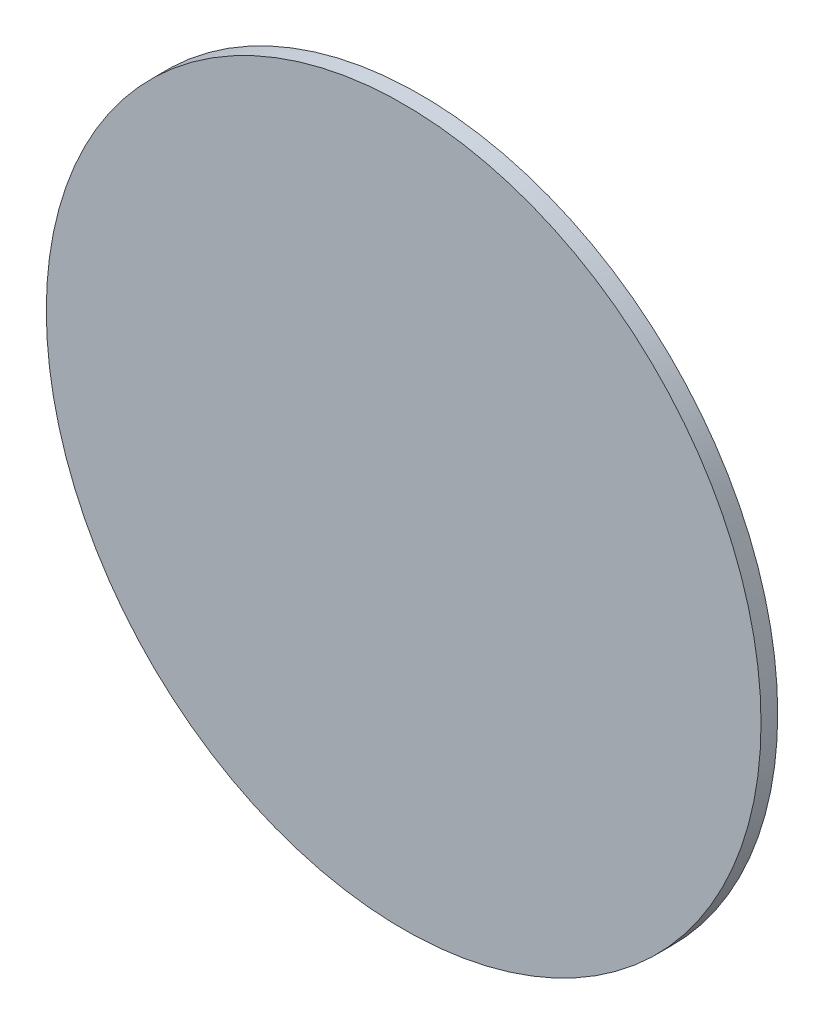
from build123d import *

# Parameters (mm, degrees)
SKETCH1_R      = 114.3
PLATFORM_DEPTH = 5.334


with BuildPart() as part:
    # Sketch1 → Platform (new body)
    with BuildSketch(Plane.XY):
        Circle(SKETCH1_R)
    extrude(amount=PLATFORM_DEPTH)


solid = part.part
